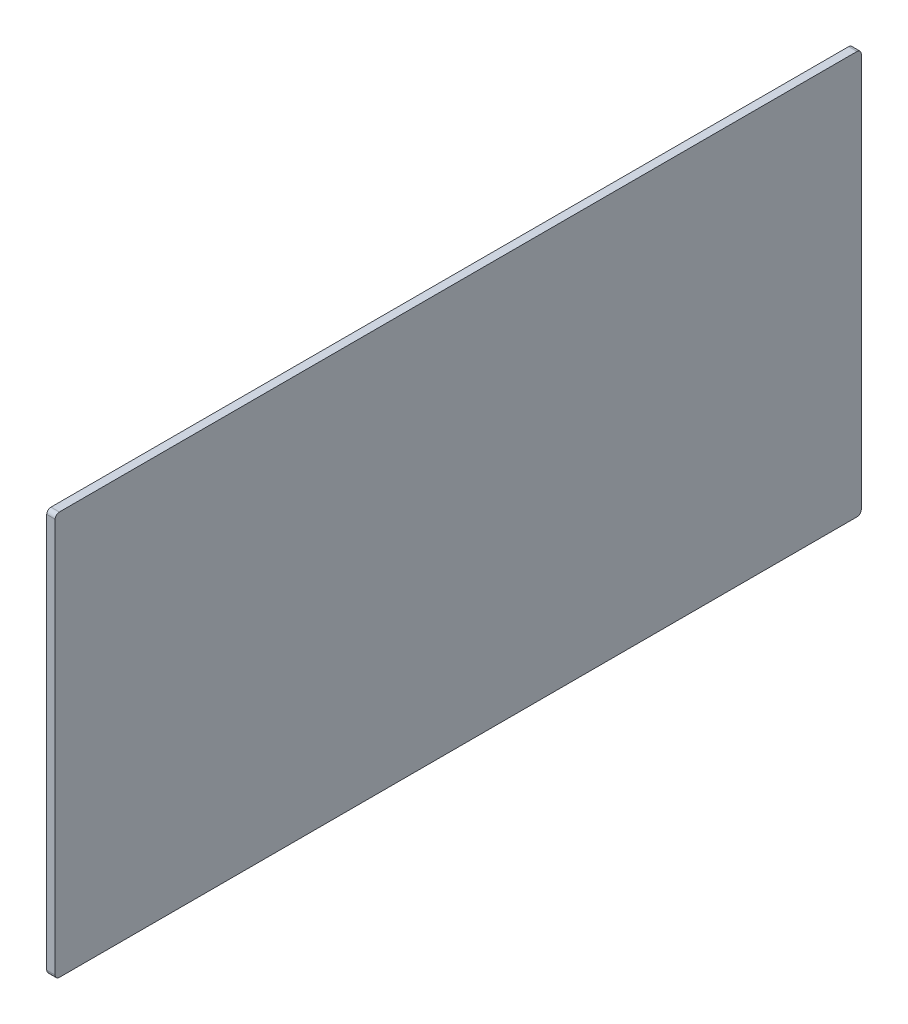
from build123d import *

# Parameters (mm, degrees)
SKETCH2_W           = 609.6
SKETCH2_H           = 304.8
BOSS_EXTRUDE1_DEPTH = 6.35
FILLET1_R           = 3.175


with BuildPart() as part:
    # Sketch2 → Boss-Extrude1 (new body)
    with BuildSketch(Plane(origin=(0, 0, 0), x_dir=(0, 0, -1), z_dir=(1, 0, 0))):
        with Locations((304.8, 152.4)):
            Rectangle(SKETCH2_W, SKETCH2_H)
    extrude(amount=BOSS_EXTRUDE1_DEPTH)

    # Fillet1
    fillet1_edges = [part.edges().sort_by_distance(p)[0] for p in [
        (3.175, 304.8, 0),
        (3.175, 304.8, -609.6),
        (3.175, 0, -609.6),
        (3.175, 0, 0),
    ]]
    fillet(fillet1_edges, radius=FILLET1_R)


solid = part.part
